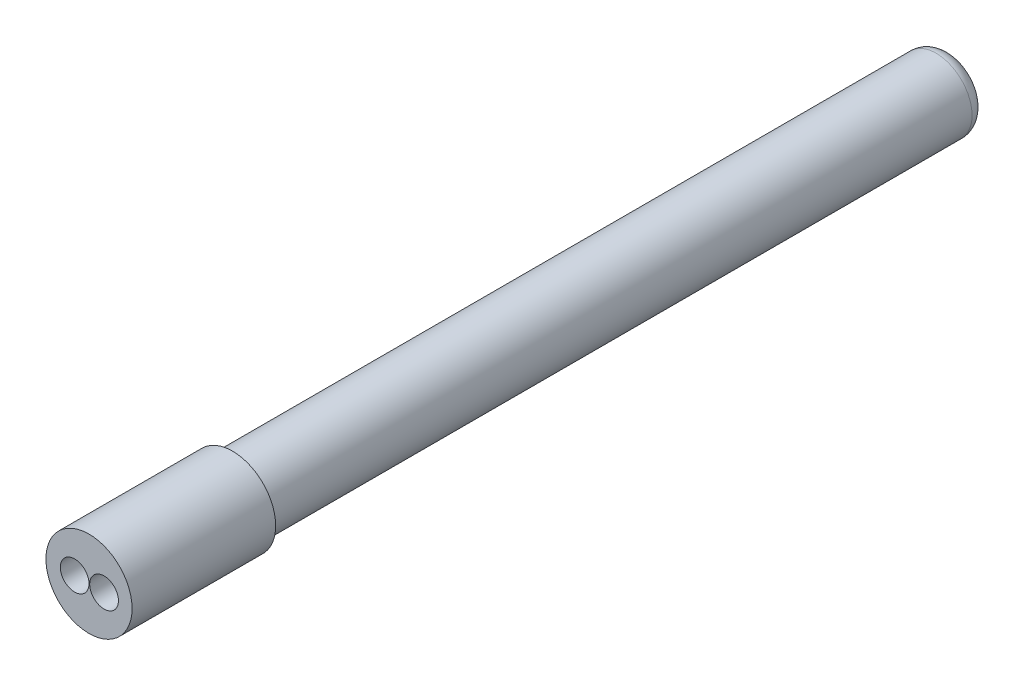
from build123d import *

# Parameters (mm, degrees)
SKETCH1_R           = 5
BOSS_EXTRUDE1_DEPTH = 100
FILLET3_R           = 2
SKETCH2_R           = 6
BOSS_EXTRUDE2_DEPTH = 20
SKETCH3_R           = 2
CUT_EXTRUDE2_DEPTH  = 20


with BuildPart() as part:
    # Sketch1 → Boss-Extrude1 (new body)
    with BuildSketch(Plane.XY):
        Circle(SKETCH1_R)
    extrude(amount=BOSS_EXTRUDE1_DEPTH)

    # Fillet3
    fillet3_edges = [part.edges().sort_by_distance(p)[0] for p in [
        (-5, 0, 0),
    ]]
    fillet(fillet3_edges, radius=FILLET3_R)

    # Sketch2 → Boss-Extrude2 (add)
    with BuildSketch(Plane.XY.offset(100)):
        Circle(SKETCH2_R)
    extrude(amount=BOSS_EXTRUDE2_DEPTH)

    # Sketch3 → Cut-Extrude2 (cut)
    with BuildSketch(Plane.XY.offset(120)):
        with Locations((-2, 0)):
            Circle(SKETCH3_R)
        with Locations((2.1, 0)):
            Circle(SKETCH3_R)
    extrude(amount=-CUT_EXTRUDE2_DEPTH, mode=Mode.SUBTRACT)


solid = part.part
